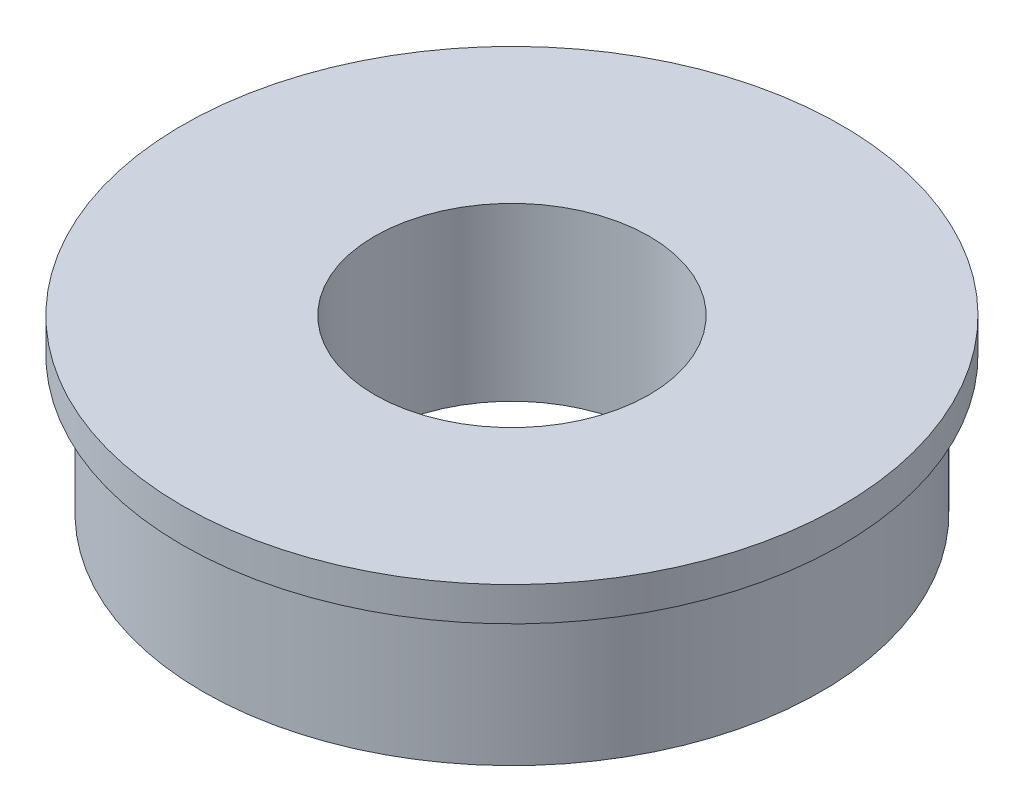
from build123d import *

# Parameters (mm, degrees)
SKETCH1_R           = 14.2875
SKETCH1_R_2         = 6.35
BOSS_EXTRUDE1_DEPTH = 6.35
SKETCH2_R           = 15.24
SKETCH2_R_2         = 6.35
BOSS_EXTRUDE2_DEPTH = 1.5748


with BuildPart() as part:
    # Sketch1 → Boss-Extrude1 (new body)
    with BuildSketch(Plane(origin=(0, 0, 0), x_dir=(1, 0, 0), z_dir=(0, 1, 0))):
        with Locations(Location((0, 0, 0), (0, 0, 270))):
            Circle(SKETCH1_R)
        with Locations(Location((0, 0, 0), (0, 0, 270))):
            Circle(SKETCH1_R_2, mode=Mode.SUBTRACT)
    extrude(amount=BOSS_EXTRUDE1_DEPTH)

    # Sketch2 → Boss-Extrude2 (add)
    with BuildSketch(Plane(origin=(0, 6.35, 0), x_dir=(1, 0, 0), z_dir=(0, 1, 0))):
        with Locations(Location((0, 0, 0), (0, 0, 270))):
            Circle(SKETCH2_R)
        with Locations(Location((0, 0, 0), (0, 0, 270))):
            Circle(SKETCH2_R_2, mode=Mode.SUBTRACT)
    extrude(amount=BOSS_EXTRUDE2_DEPTH)


solid = part.part
